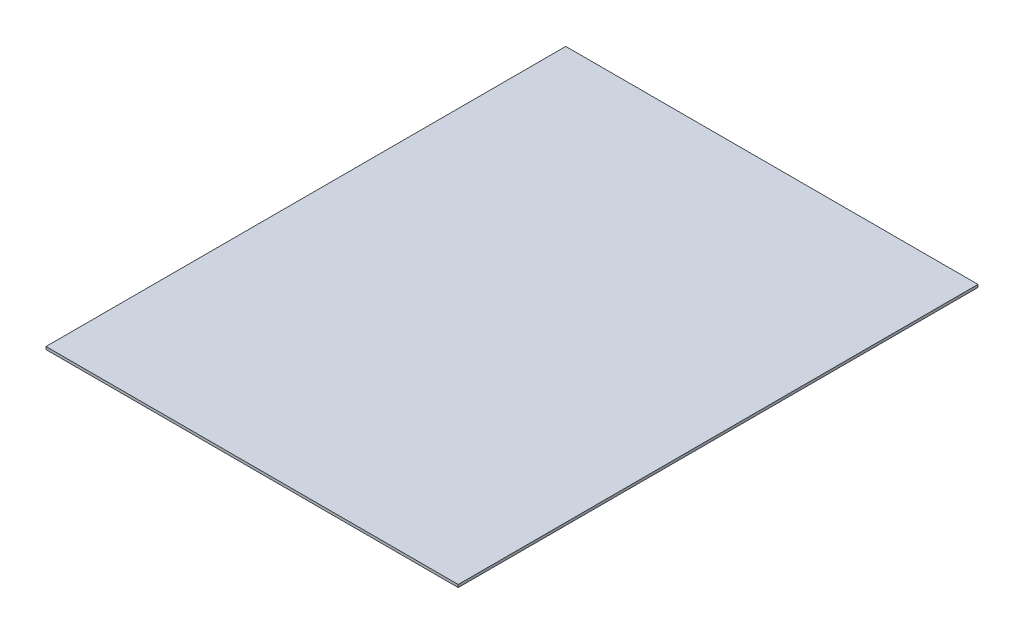
from build123d import *

# Parameters (mm, degrees)
SKETCH1_W           = 460
SKETCH1_H           = 580
BOSS_EXTRUDE1_DEPTH = 3


with BuildPart() as part:
    # Sketch1 → Boss-Extrude1 (new body)
    with BuildSketch(Plane(origin=(0, 0, 0), x_dir=(1, 0, 0), z_dir=(0, 1, 0))):
        Rectangle(SKETCH1_W, SKETCH1_H)
    extrude(amount=BOSS_EXTRUDE1_DEPTH)


solid = part.part
